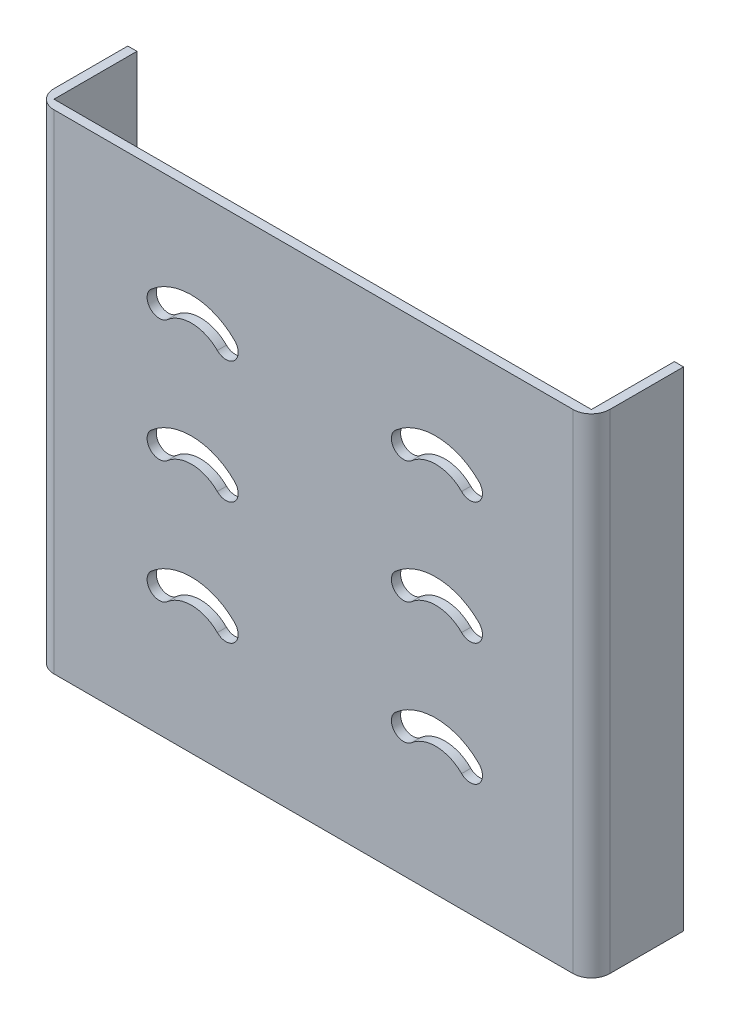
from build123d import *

# Parameters (mm, degrees)
BOSS_EXTRUDE1_DEPTH = 80
FILLET1_R           = 3
CUT_EXTRUDE1_DEPTH  = 1.5


with BuildPart() as part:
    # Sketch1 → Boss-Extrude1 (new body)
    with BuildSketch(Plane(origin=(0, 0, 0), x_dir=(1, 0, 0), z_dir=(0, 1, 0))):
        Polygon((-45.5, 0), (45.5, 0), (45.5, 15.083653846), (44, 15.083653846), (44, 1.5), (-44, 1.5), (-44, 15.083653846), (-45.5, 15.083653846), align=None)
    extrude(amount=BOSS_EXTRUDE1_DEPTH)

    # Fillet1
    fillet1_edges = [part.edges().sort_by_distance(p)[0] for p in [
        (45.5, 40, 0),
        (-45.5, 40, 0),
    ]]
    fillet(fillet1_edges, radius=FILLET1_R)

    # Sketch2 → Cut-Extrude1 (cut)
    with BuildSketch(Plane.XY):
        with BuildLine():
            ThreePointArc((-12.928932188, 62.071067812), (-19.653586872, 64.993998096), (-26.564488849, 62.543705068))
            ThreePointArc((-26.564488849, 62.543705068), (-26.760332093, 59.722066284), (-23.938693309, 59.526223041))
            ThreePointArc((-23.938693309, 59.526223041), (-19.792152123, 60.996398858), (-15.757359313, 59.242640687))
            ThreePointArc((-15.757359313, 59.242640687), (-12.928932188, 59.242640687), (-12.928932188, 62.071067812))
        make_face()
        with BuildLine():
            ThreePointArc((27.071067812, 62.071067812), (20.346413128, 64.993998096), (13.435511151, 62.543705068))
            ThreePointArc((13.435511151, 62.543705068), (13.239667907, 59.722066284), (16.061306691, 59.526223041))
            ThreePointArc((16.061306691, 59.526223041), (20.207847877, 60.996398858), (24.242640687, 59.242640687))
            ThreePointArc((24.242640687, 59.242640687), (27.071067812, 59.242640687), (27.071067812, 62.071067812))
        make_face()
        with BuildLine():
            ThreePointArc((27.071067812, 42.071067812), (20.346413128, 44.993998096), (13.435511151, 42.543705068))
            ThreePointArc((13.435511151, 42.543705068), (13.239667907, 39.722066284), (16.061306691, 39.526223041))
            ThreePointArc((16.061306691, 39.526223041), (20.207847877, 40.996398858), (24.242640687, 39.242640687))
            ThreePointArc((24.242640687, 39.242640687), (27.071067812, 39.242640687), (27.071067812, 42.071067812))
        make_face()
        with BuildLine():
            ThreePointArc((27.071067812, 22.071067812), (20.346413128, 24.993998096), (13.435511151, 22.543705068))
            ThreePointArc((13.435511151, 22.543705068), (13.239667907, 19.722066284), (16.061306691, 19.526223041))
            ThreePointArc((16.061306691, 19.526223041), (20.207847877, 20.996398858), (24.242640687, 19.242640687))
            ThreePointArc((24.242640687, 19.242640687), (27.071067812, 19.242640687), (27.071067812, 22.071067812))
        make_face()
        with BuildLine():
            ThreePointArc((-12.928932188, 42.071067812), (-19.653586872, 44.993998096), (-26.564488849, 42.543705068))
            ThreePointArc((-26.564488849, 42.543705068), (-26.760332093, 39.722066284), (-23.938693309, 39.526223041))
            ThreePointArc((-23.938693309, 39.526223041), (-19.792152123, 40.996398858), (-15.757359313, 39.242640687))
            ThreePointArc((-15.757359313, 39.242640687), (-12.928932188, 39.242640687), (-12.928932188, 42.071067812))
        make_face()
        with BuildLine():
            ThreePointArc((-12.928932188, 22.071067812), (-19.653586872, 24.993998096), (-26.564488849, 22.543705068))
            ThreePointArc((-26.564488849, 22.543705068), (-26.760332093, 19.722066284), (-23.938693309, 19.526223041))
            ThreePointArc((-23.938693309, 19.526223041), (-19.792152123, 20.996398858), (-15.757359313, 19.242640687))
            ThreePointArc((-15.757359313, 19.242640687), (-12.928932188, 19.242640687), (-12.928932188, 22.071067812))
        make_face()
    extrude(amount=-CUT_EXTRUDE1_DEPTH, mode=Mode.SUBTRACT)


solid = part.part
